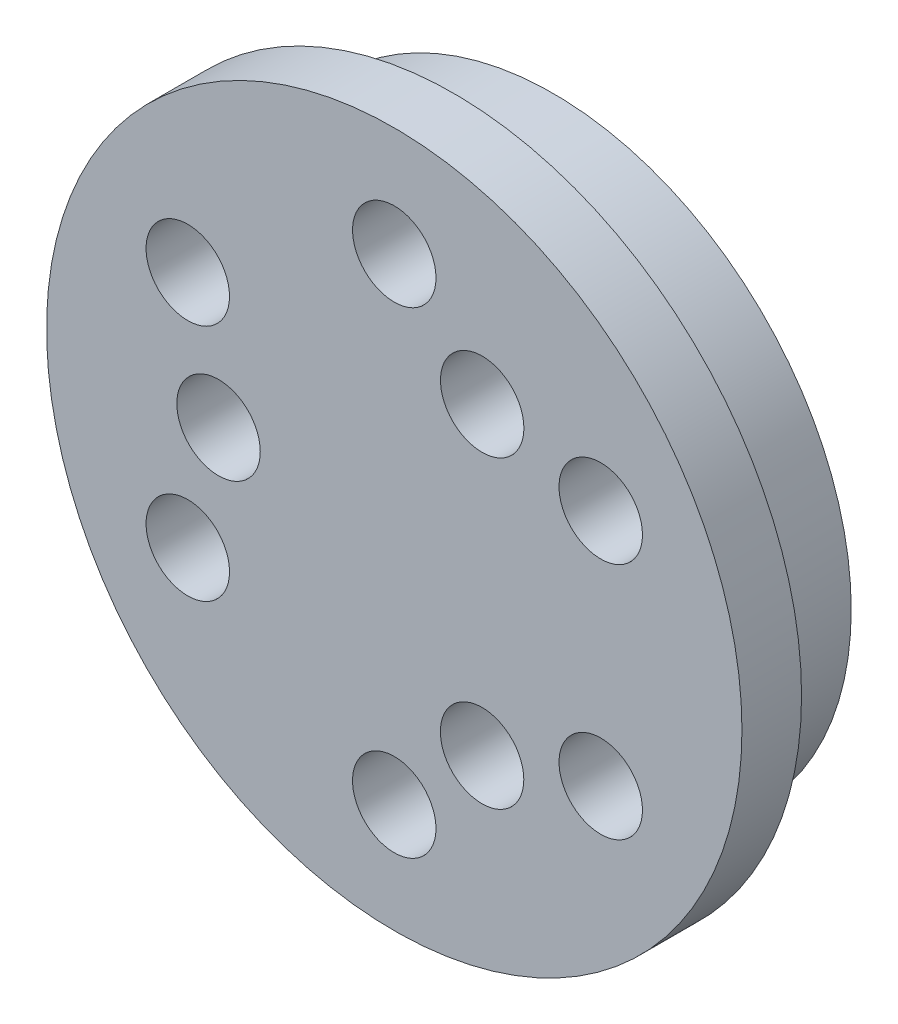
from build123d import *

# Parameters (mm, degrees)
SKETCH_1_R      = 15
SKETCH_1_R_2    = 2.1
EXTRUDE_1_DEPTH = 7
EXTRUDE_START   = -2
SKETCH_2_R      = 17.5
SKETCH_2_R_2    = 2.1
EXTRUDE_2_DEPTH = 2
SKETCH_5_R      = 17.5
SKETCH_5_R_2    = 2.1
EXTRUDE_4_DEPTH = 1


with BuildPart() as part:
    # 草图1 → 凸台-拉伸1 (new body)
    with BuildSketch(Plane.XY):
        Circle(SKETCH_1_R)
        with Locations((0, 12)):
            Circle(SKETCH_1_R_2, mode=Mode.SUBTRACT)
        with Locations((10.392304845, 6)):
            Circle(SKETCH_1_R_2, mode=Mode.SUBTRACT)
        with Locations((10.392304845, -6)):
            Circle(SKETCH_1_R_2, mode=Mode.SUBTRACT)
        with Locations((0, -12)):
            Circle(SKETCH_1_R_2, mode=Mode.SUBTRACT)
        with Locations((-10.392304845, -6)):
            Circle(SKETCH_1_R_2, mode=Mode.SUBTRACT)
        with Locations((-10.392304845, 6)):
            Circle(SKETCH_1_R_2, mode=Mode.SUBTRACT)
        with Locations((4.425, 7.664324823)):
            Circle(SKETCH_1_R_2, mode=Mode.SUBTRACT)
        with Locations((4.419693866, -7.655134331)):
            Circle(SKETCH_1_R_2, mode=Mode.SUBTRACT)
        with Locations((-8.844693866, 0.009190493)):
            Circle(SKETCH_1_R_2, mode=Mode.SUBTRACT)
    extrude(amount=EXTRUDE_1_DEPTH)

    # 草图2 → 凸台-拉伸2 (add)
    with BuildSketch(Plane.XY.offset(7).offset(EXTRUDE_START)):
        Circle(SKETCH_2_R)
        with Locations((-8.844693866, 0.009190493)):
            Circle(SKETCH_2_R_2, mode=Mode.SUBTRACT)
        with Locations((-10.392304845, -6)):
            Circle(SKETCH_2_R_2, mode=Mode.SUBTRACT)
        with Locations((0, -12)):
            Circle(SKETCH_2_R_2, mode=Mode.SUBTRACT)
        with Locations((4.419693866, -7.655134331)):
            Circle(SKETCH_2_R_2, mode=Mode.SUBTRACT)
        with Locations((10.392304845, -6)):
            Circle(SKETCH_2_R_2, mode=Mode.SUBTRACT)
        with Locations((10.392304845, 6)):
            Circle(SKETCH_2_R_2, mode=Mode.SUBTRACT)
        with Locations((4.425, 7.664324823)):
            Circle(SKETCH_2_R_2, mode=Mode.SUBTRACT)
        with Locations((0, 12)):
            Circle(SKETCH_2_R_2, mode=Mode.SUBTRACT)
        with Locations((-10.392304845, 6)):
            Circle(SKETCH_2_R_2, mode=Mode.SUBTRACT)
    extrude(amount=EXTRUDE_2_DEPTH)

    # 草图5 → 凸台-拉伸4 (add)
    with BuildSketch(Plane.XY.offset(7)):
        Circle(SKETCH_5_R)
        with Locations((-10.392304845, -6)):
            Circle(SKETCH_5_R_2, mode=Mode.SUBTRACT)
        with Locations((0, -12)):
            Circle(SKETCH_5_R_2, mode=Mode.SUBTRACT)
        with Locations((4.419693866, -7.655134331)):
            Circle(SKETCH_5_R_2, mode=Mode.SUBTRACT)
        with Locations((10.392304845, -6)):
            Circle(SKETCH_5_R_2, mode=Mode.SUBTRACT)
        with Locations((10.392304845, 6)):
            Circle(SKETCH_5_R_2, mode=Mode.SUBTRACT)
        with Locations((4.425, 7.664324823)):
            Circle(SKETCH_5_R_2, mode=Mode.SUBTRACT)
        with Locations((0, 12)):
            Circle(SKETCH_5_R_2, mode=Mode.SUBTRACT)
        with Locations((-8.844693866, 0.009190493)):
            Circle(SKETCH_5_R_2, mode=Mode.SUBTRACT)
        with Locations((-10.392304845, 6)):
            Circle(SKETCH_5_R_2, mode=Mode.SUBTRACT)
    extrude(amount=EXTRUDE_4_DEPTH)


solid = part.part
